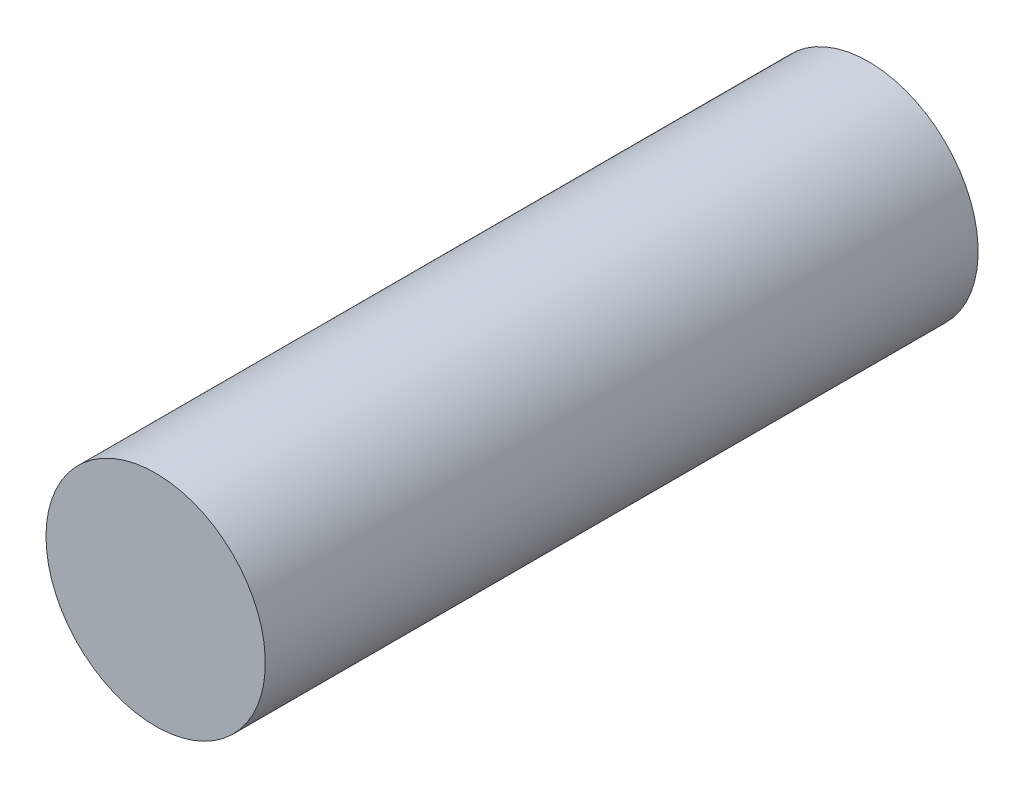
from build123d import *

# Parameters (mm, degrees)
SKETCH1_R           = 8
BOSS_EXTRUDE1_DEPTH = 52


with BuildPart() as part:
    # Sketch1 → Boss-Extrude1 (new body)
    with BuildSketch(Plane.XY):
        with Locations(Location((0, 0, 0), (0, 0, 180))):
            Circle(SKETCH1_R)
    extrude(amount=BOSS_EXTRUDE1_DEPTH)


solid = part.part
